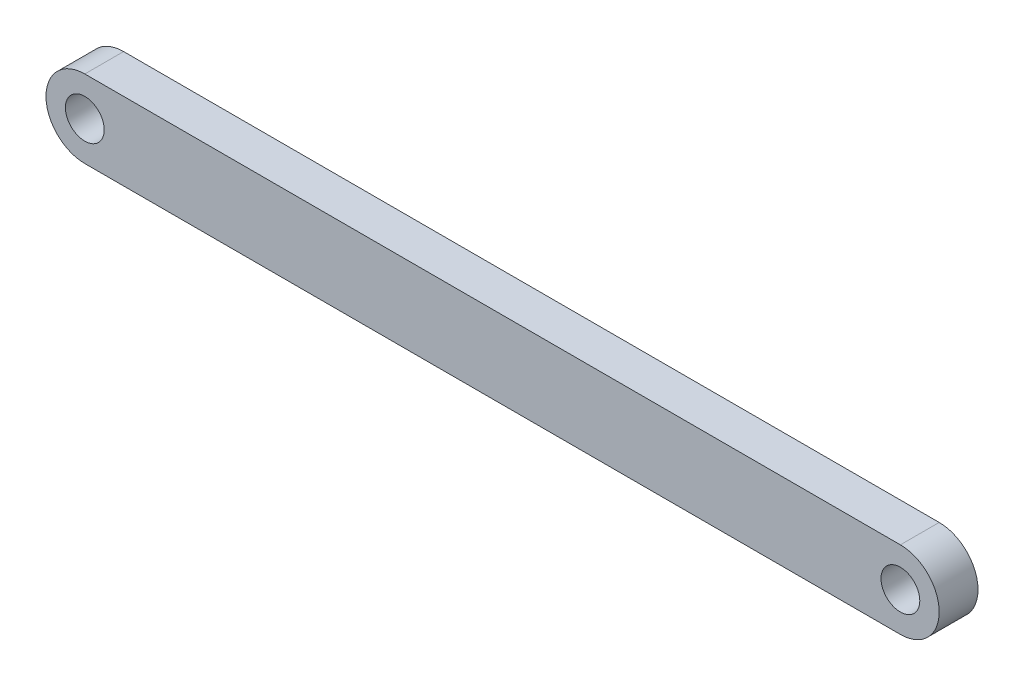
from build123d import *

# Parameters (mm, degrees)
ESBO_O1_R                = 2.5
RESSALTO_EXTRUS_O1_DEPTH = 5


with BuildPart() as part:
    # Esboço1 → Ressalto-extrusão1 (new body)
    with BuildSketch(Plane.XY):
        with BuildLine():
            Line((-52.54, 5), (52.54, 5))
            ThreePointArc((52.54, 5), (57.54, 0), (52.54, -5))
            Line((52.54, -5), (-52.54, -5))
            ThreePointArc((-52.54, -5), (-57.54, 0), (-52.54, 5))
        make_face()
        with Locations((-52.54, 0)):
            Circle(ESBO_O1_R, mode=Mode.SUBTRACT)
        with Locations((52.54, 0)):
            Circle(ESBO_O1_R, mode=Mode.SUBTRACT)
    extrude(amount=RESSALTO_EXTRUS_O1_DEPTH)


solid = part.part
